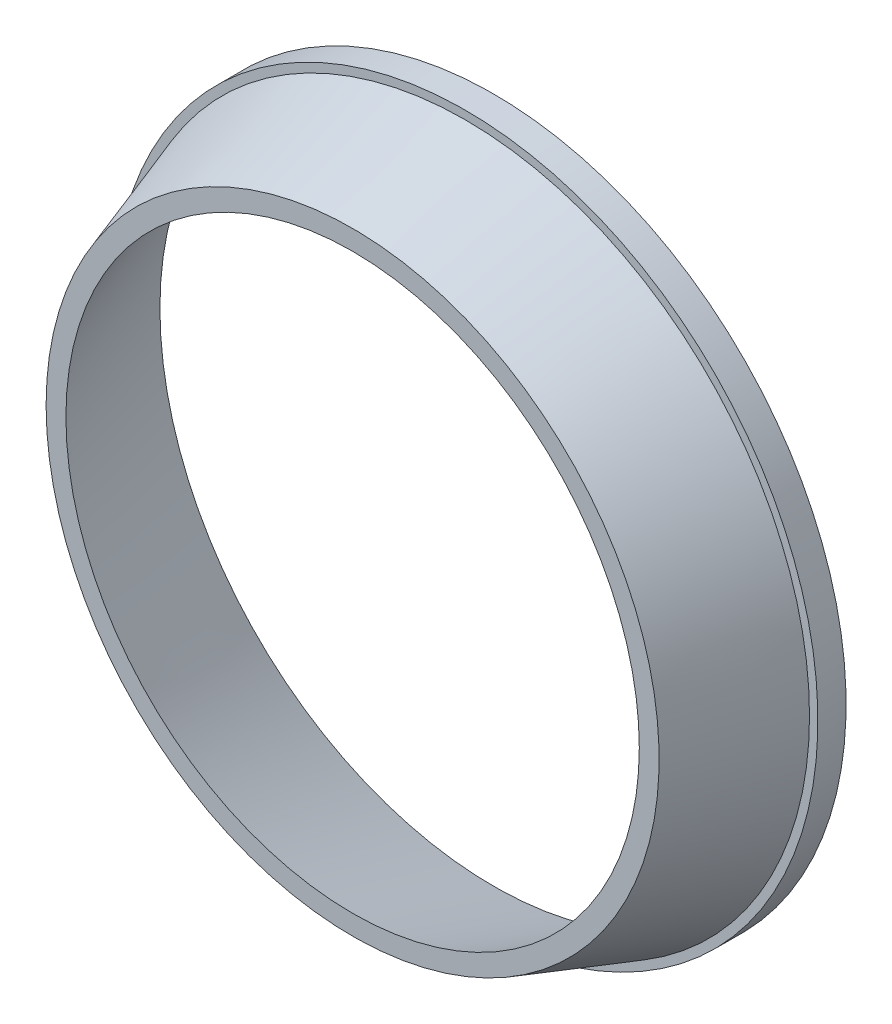
from build123d import *


with BuildPart() as part:
    # Sketch1 → Revolve1 (revolve)
    with BuildSketch(Plane(origin=(0, 0, 0), x_dir=(1, 0, 0), z_dir=(0, 1, 0)), mode=Mode.PRIVATE) as revolve1_sk:
        Polygon((37.5, 0), (37.5, -3), (36.608185107, -3), (32.608185107, -15), (30.5, -15), (35.5, 0), align=None)
    revolve(revolve1_sk.sketch.rotate(Axis((0, 0, 0), (0, 0, 1)), 180), axis=Axis((0, 0, 0), (0, 0, 1)))


solid = part.part
